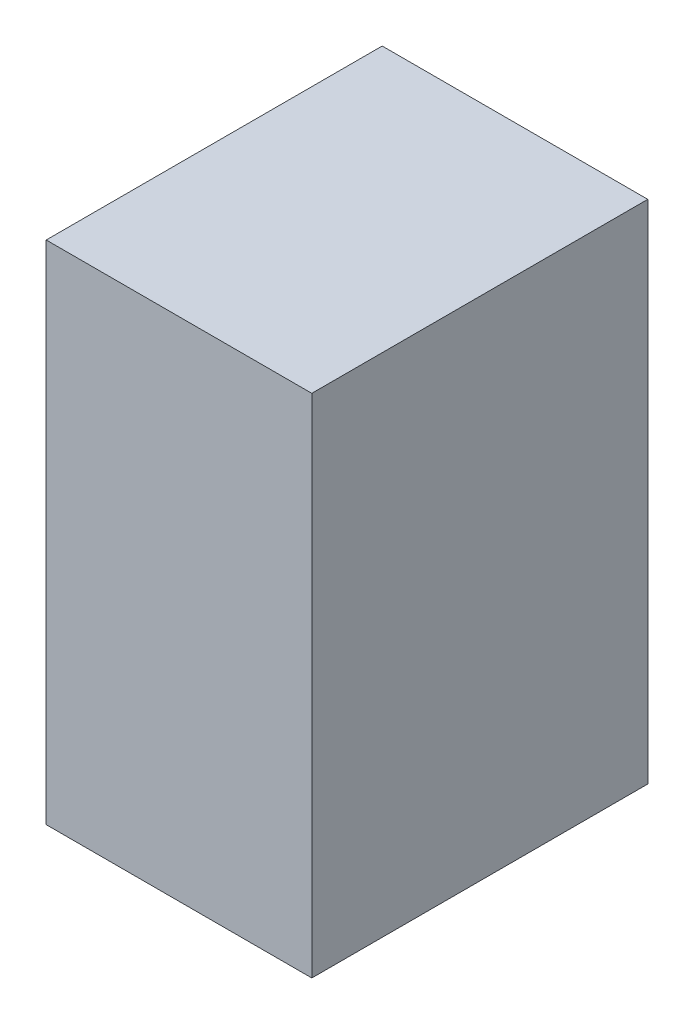
from build123d import *

# Parameters (mm, degrees)
SKETCH3_W               = 25
SKETCH3_H               = 53
SKETCH3_W_2             = 12.5
SKETCH3_H_2             = 40
BOSS_EXTRUDE1_DEPTH     = 120
SKETCH4_W               = 82.5
SKETCH4_H               = 93
BOSS_EXTRUDE2_DEPTH     = 10
BOSS_EXTRUDE3_DEPTH     = 25
CUT_EXTRUDE1_DEPTH      = 1356.562056513
CUT_EXTRUDE1_DEPTH_BACK = 1356.562056513
SKETCH10_R              = 0.5
SKETCH11_W              = 25
SKETCH11_H              = 3.81
BOSS_EXTRUDE11_DEPTH    = 15
SKETCH12_W              = 3
SKETCH12_H              = 42.953894286
BOSS_EXTRUDE12_DEPTH    = 24
SKETCH12_H_2            = 37.953894286
BOSS_EXTRUDE12_2_DEPTH  = 24
SKETCH13_W              = 40.2
SKETCH13_H              = 5.16
BOSS_EXTRUDE13_DEPTH    = 10.402357812
SKETCH14_W              = 82.5
SKETCH14_H              = 155.5
BOSS_EXTRUDE14_DEPTH    = 5
SKETCH15_W              = 155.5
SKETCH15_H              = 93
SKETCH15_R              = 37.4
BOSS_EXTRUDE15_DEPTH    = 20
BOSS_EXTRUDE16_DEPTH    = 21.930019373
SKETCH6_W               = 125
SKETCH6_H               = 93
SKETCH6_R               = 35
BOSS_EXTRUDE4_DEPTH     = 25
SKETCH7_W               = 802.519036646
SKETCH7_H               = 1209.452633117
BOSS_EXTRUDE5_DEPTH     = 634.373940653
SKETCH9_W               = 46
SKETCH9_H               = 158.10999934
BOSS_EXTRUDE7_DEPTH     = 10.402357812


with BuildPart() as part:
    # Sketch3 → Boss-Extrude1 (new body)
    with BuildSketch(Plane.XY.offset(120)):
        with Locations((-675.180952072, -1302.669902776)):
            Rectangle(SKETCH3_W, SKETCH3_H)
        with Locations((-675.180952072, -1302.669902776)):
            Rectangle(SKETCH3_W_2, SKETCH3_H_2, mode=Mode.SUBTRACT)
    extrude(amount=-BOSS_EXTRUDE1_DEPTH)

    # Sketch4 → Boss-Extrude2 (add)
    with BuildSketch(Plane.XY.offset(120)):
        with Locations((-675.180952072, -1302.669902776)):
            Rectangle(SKETCH4_W, SKETCH4_H)
    extrude(amount=-BOSS_EXTRUDE2_DEPTH)

    # Sketch5 → Boss-Extrude3 (add)
    with BuildSketch(Plane.ZY.offset(687.680952072)):
        with BuildLine():
            Line((-3.81, -1276.169902776), (0, -1276.169902776))
            Line((0, -1276.169902776), (0, -1280.169902776))
            Line((0, -1280.169902776), (7.5, -1280.169902776))
            Line((7.5, -1280.169902776), (7.5, -1276.169902776))
            Line((7.5, -1276.169902776), (4, -1276.169902776))
            ThreePointArc((4, -1276.169902776), (1.171572875, -1274.998329901), (0, -1272.169902776))
            Line((0, -1272.169902776), (0, -1271.169902776))
            Line((0, -1271.169902776), (-3.81, -1271.169902776))
            Line((-3.81, -1271.169902776), (-3.81, -1276.169902776))
        make_face()
        with BuildLine():
            Line((7.5, -1329.169902776), (7.5, -1325.169902776))
            Line((7.5, -1325.169902776), (0, -1325.169902776))
            Line((0, -1325.169902776), (0, -1329.169902776))
            Line((0, -1329.169902776), (-3.81, -1329.169902776))
            Line((-3.81, -1329.169902776), (-3.81, -1334.169902776))
            Line((-3.81, -1334.169902776), (0, -1334.169902776))
            Line((0, -1334.169902776), (0, -1333.169902776))
            ThreePointArc((0, -1333.169902776), (1.171572875, -1330.341475652), (4, -1329.169902776))
            Line((4, -1329.169902776), (7.5, -1329.169902776))
        make_face()
    extrude(amount=-BOSS_EXTRUDE3_DEPTH)

    # Sketch10 → Cut-Extrude1 (cut, two sides: drawn at the far end of the back side and taken through both)
    with BuildSketch(Plane.ZY.offset(687.680952072).offset(-CUT_EXTRUDE1_DEPTH_BACK)):
        with Locations((0, -1329.169902776)):
            Circle(SKETCH10_R)
        with Locations((0, -1276.169902776)):
            Circle(SKETCH10_R)
    extrude(amount=CUT_EXTRUDE1_DEPTH + CUT_EXTRUDE1_DEPTH_BACK, mode=Mode.SUBTRACT)

    # Sketch11 → Boss-Extrude11 (add)
    with BuildSketch(Plane(origin=(0, -1256.169902776, 0), x_dir=(1, 0, 0), z_dir=(0, 1, 0))):
        with Locations((-675.180952072, 1.905)):
            Rectangle(SKETCH11_W, SKETCH11_H)
    extrude(amount=-BOSS_EXTRUDE11_DEPTH)



with BuildPart() as body_2:
    # Sketch12 → Boss-Extrude12 (new body)
    with BuildSketch(Plane(origin=(0, -1256.169902776, 0), x_dir=(1, 0, 0), z_dir=(0, 1, 0))):
        with Locations((-709.260971445, -8.976947143)):
            Rectangle(SKETCH12_W, SKETCH12_H)
    extrude(amount=-BOSS_EXTRUDE12_DEPTH)


with BuildPart() as body_3:
    # Sketch12 → Boss-Extrude12 2 (new body)
    with BuildSketch(Plane(origin=(0, -1256.169902776, 0), x_dir=(1, 0, 0), z_dir=(0, 1, 0))):
        with Locations((-641.100932699, -6.476947143)):
            Rectangle(SKETCH12_W, SKETCH12_H_2)
    extrude(amount=-BOSS_EXTRUDE12_2_DEPTH)


with BuildPart() as body_4:
    # Sketch13 → Boss-Extrude13 (new body)
    with BuildSketch(Plane(origin=(0, -1256.169902776, 0), x_dir=(1, 0, 0), z_dir=(0, 1, 0))):
        with Locations((-675.181777911, 32.98999934)):
            Rectangle(SKETCH13_W, SKETCH13_H)
    extrude(amount=-BOSS_EXTRUDE13_DEPTH)


with BuildPart() as part_1:
    add(part.part)

    add(body_2.part)  # Boss-Extrude14 merges body 2

    add(body_3.part)  # Boss-Extrude14 merges body 3

    add(body_4.part)  # Boss-Extrude14 merges body 4
    # Sketch14 → Boss-Extrude14 (add)
    with BuildSketch(Plane(origin=(0, -1256.169902776, 0), x_dir=(1, 0, 0), z_dir=(0, 1, 0))):
        with Locations((-675.180952072, -42.25)):
            Rectangle(SKETCH14_W, SKETCH14_H)
    extrude(amount=-BOSS_EXTRUDE14_DEPTH)



with BuildPart() as body_2_2:
    # Sketch15 → Boss-Extrude15 (new body)
    with BuildSketch(Plane.ZY.offset(738.360971445)):
        with Locations((42.25, -1302.669902776)):
            Rectangle(SKETCH15_W, SKETCH15_H)
        with Locations((69.506521341, -1302.439969052)):
            Circle(SKETCH15_R, mode=Mode.SUBTRACT)
    extrude(amount=BOSS_EXTRUDE15_DEPTH)


with BuildPart() as part_2:
    add(part_1.part)

    add(body_2_2.part)  # Boss-Extrude16 merges body 2 2
    # Sketch16 → Boss-Extrude16 (add)
    with BuildSketch(Plane.ZY.offset(716.430952072)):
        Polygon((110, -1349.169902776), (120, -1349.169902776), (120, -1256.169902776), (-35.5, -1256.169902776), (-35.5, -1261.169902776), (110, -1261.169902776), align=None)
    extrude(amount=BOSS_EXTRUDE16_DEPTH)


with BuildPart() as body_2_3:
    # Sketch6 → Boss-Extrude4 (new body)
    with BuildSketch(Plane.ZY.offset(738.360971445)):
        with Locations((57.5, -1302.669902776)):
            Rectangle(SKETCH6_W, SKETCH6_H)
        with Locations((79.506521341, -1302.899836501)):
            Circle(SKETCH6_R, mode=Mode.SUBTRACT)
    extrude(amount=BOSS_EXTRUDE4_DEPTH)


with BuildPart() as body_3_2:
    # Sketch7 → Boss-Extrude5 (new body)
    with BuildSketch(Plane.ZY.offset(103.987030792)):
        with Locations((521.259518323, -651.443586218)):
            Rectangle(SKETCH7_W, SKETCH7_H)
    extrude(amount=BOSS_EXTRUDE5_DEPTH)


with BuildPart() as body_4_2:
    # Sketch9 → Boss-Extrude7 (new body)
    with BuildSketch(Plane(origin=(0, -1266.572260588, 0), x_dir=(1, 0, 0), z_dir=(0, 1, 0))):
        with Locations((-675.180947929, -40.94500033)):
            Rectangle(SKETCH9_W, SKETCH9_H)
    extrude(amount=BOSS_EXTRUDE7_DEPTH)


solid = Compound([part_2.part, body_2_3.part, body_3_2.part, body_4_2.part])
